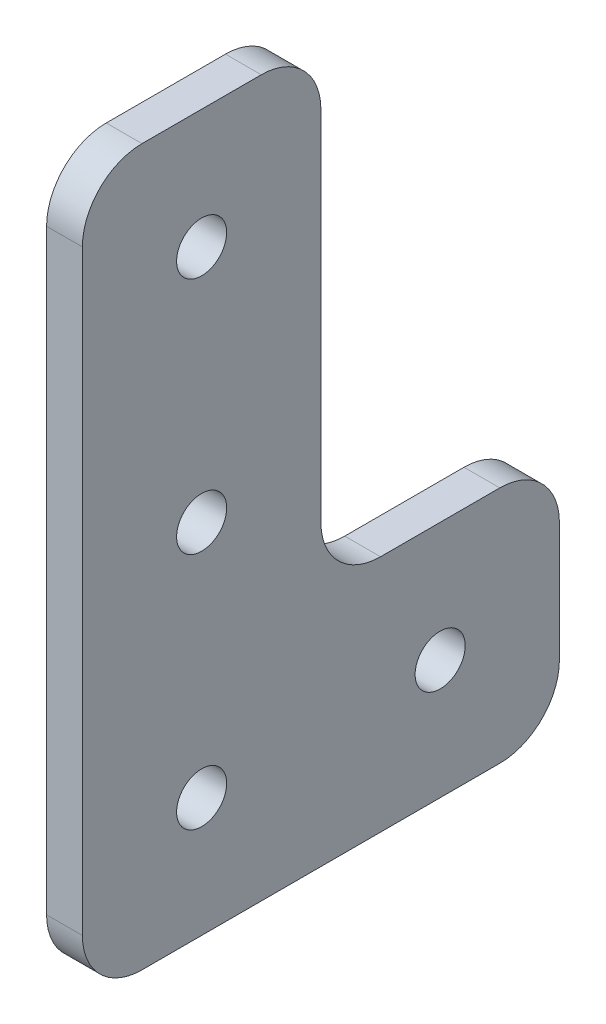
from build123d import *

# Parameters (mm, degrees)
SKETCH_1_R      = 2.1
EXTRUDE_1_DEPTH = 3
FILLET_2_R      = 5


with BuildPart() as part:
    # 草图1 → 凸台-拉伸1 (new body)
    with BuildSketch(Plane(origin=(0, 0, 0), x_dir=(0, 0, -1), z_dir=(1, 0, 0))):
        Polygon((10, -10), (30, -10), (30, -30), (10, -30), (-10, -30), (-10, 30), (10, 30), align=None)
        with Locations((0, 20)):
            Circle(SKETCH_1_R, mode=Mode.SUBTRACT)
        Circle(SKETCH_1_R, mode=Mode.SUBTRACT)
        with Locations((0, -20)):
            Circle(SKETCH_1_R, mode=Mode.SUBTRACT)
        with Locations((20, -20)):
            Circle(SKETCH_1_R, mode=Mode.SUBTRACT)
    extrude(amount=EXTRUDE_1_DEPTH)

    # 圆角2
    fillet_2_edges = [part.edges().sort_by_distance(p)[0] for p in [
        (1.5, -30, 10),
        (1.5, 30, 10),
        (1.5, 30, -10),
        (1.5, -10, -10),
        (1.5, -10, -30),
        (1.5, -30, -30),
    ]]
    fillet(fillet_2_edges, radius=FILLET_2_R)


solid = part.part
